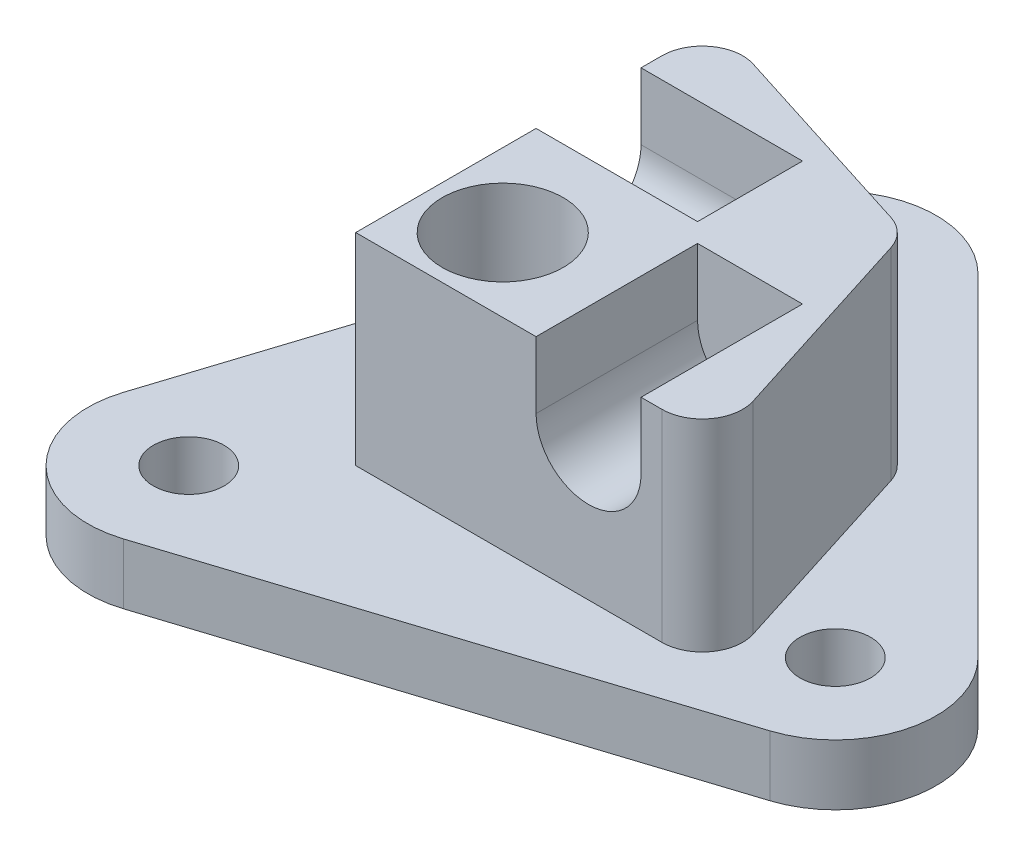
from build123d import *

# Parameters (mm, degrees)
SKETCH_1_R      = 3
SKETCH_1_R_2    = 1.75
EXTRUDE_1_DEPTH = 3
SKETCH_4_R      = 3
EXTRUDE_3_DEPTH = 10
EXTRUDE_5_REACH = 37.51


with BuildPart() as part:
    # 草图1 → 凸台-拉伸1 (new body)
    with BuildSketch(Plane(origin=(0, 0, 0), x_dir=(1, 0, 0), z_dir=(0, 1, 0))):
        with BuildLine():
            Line((-6.251193562, -12.539301448), (18.001154819, -4.761126855))
            ThreePointArc((18.001154819, -4.761126855), (21.333794073, -1.176473834), (20.009707694, 3.535533906))
            Line((20.009707694, 3.535533906), (3.535533906, 20.009707694))
            ThreePointArc((3.535533906, 20.009707694), (-1.176473834, 21.333794073), (-4.761126855, 18.001154819))
            Line((-4.761126855, 18.001154819), (-12.539301448, -6.251193562))
            ThreePointArc((-12.539301448, -6.251193562), (-11.313708499, -11.313708499), (-6.251193562, -12.539301448))
        make_face()
        with Locations(Location((0, 0, 0), (0, 0, 270))):
            Circle(SKETCH_1_R, mode=Mode.SUBTRACT)
        with Locations(Location((0, 16.474173788, 0), (0, 0, 270))):
            Circle(SKETCH_1_R_2, mode=Mode.SUBTRACT)
        with Locations(Location((16.474173788, 0, 0), (0, 0, 270))):
            Circle(SKETCH_1_R_2, mode=Mode.SUBTRACT)
        with Locations(Location((-7.778174593, -7.778174593, 0), (0, 0, 270))):
            Circle(SKETCH_1_R_2, mode=Mode.SUBTRACT)
    extrude(amount=EXTRUDE_1_DEPTH)

    # 草图4 → 凸台-拉伸3 (add)
    with BuildSketch(Plane(origin=(0, 3, 0), x_dir=(1, 0, 0), z_dir=(0, 1, 0))):
        with BuildLine():
            ThreePointArc((-1.03695933, 13.436395181), (-2.822849114, 13.143867789), (-3.641592762, 11.529980113))
            Line((-3.641592762, 11.529980113), (-3.641592762, 10.493))
            Line((-3.641592762, 10.493), (4.358407238, 10.493))
            Line((4.358407238, 10.493), (4.358407238, 5.293))
            Line((4.358407238, 5.293), (-3.641592762, 5.293))
            Line((-3.641592762, 5.293), (-3.641592762, -3.641592762))
            Line((-3.641592762, -3.641592762), (5.293, -3.641592762))
            Line((5.293, -3.641592762), (5.293, 4.358407238))
            Line((5.293, 4.358407238), (10.493, 4.358407238))
            Line((10.493, 4.358407238), (10.493, -3.641592762))
            Line((10.493, -3.641592762), (11.529980113, -3.641592762))
            ThreePointArc((11.529980113, -3.641592762), (13.143867789, -2.822849114), (13.436395181, -1.03695933))
            Line((13.436395181, -1.03695933), (10.264822306, 8.96304067))
            ThreePointArc((10.264822306, 8.96304067), (9.7726208, 9.7726208), (8.96304067, 10.264822306))
            Line((8.96304067, 10.264822306), (-1.03695933, 13.436395181))
        make_face()
        Circle(SKETCH_4_R, mode=Mode.SUBTRACT)
    extrude(amount=EXTRUDE_3_DEPTH)

    # 草图8 → 凸台-拉伸5 (add, up to next)
    with BuildSketch(Plane.XY.offset(3.641592762), mode=Mode.PRIVATE) as extrude_5_sk1:
        with BuildLine():
            ThreePointArc((10.493, 9.7), (7.893, 7.1), (5.293, 9.7))
            Line((5.293, 9.7), (5.293, 3))
            Line((5.293, 3), (10.493, 3))
            Line((10.493, 3), (10.493, 9.7))
        make_face()
    extrude_5_tool1 = extrude(extrude_5_sk1.sketch, amount=-EXTRUDE_5_REACH, mode=Mode.PRIVATE) - part.part
    extrude_5 = extrude_5_tool1.solids().sort_by_distance((7.893, 5.365131, 3.641593))[0]
    add(extrude_5)

    # 镜向7: 凸台-拉伸5 across plane
    add(extrude_5.mirror(Plane(origin=(0, 0, 0), x_dir=(-0.7071067811865476, 0, 0.7071067811865475), z_dir=(0.7071067811865475, 0, 0.7071067811865476))))


solid = part.part
